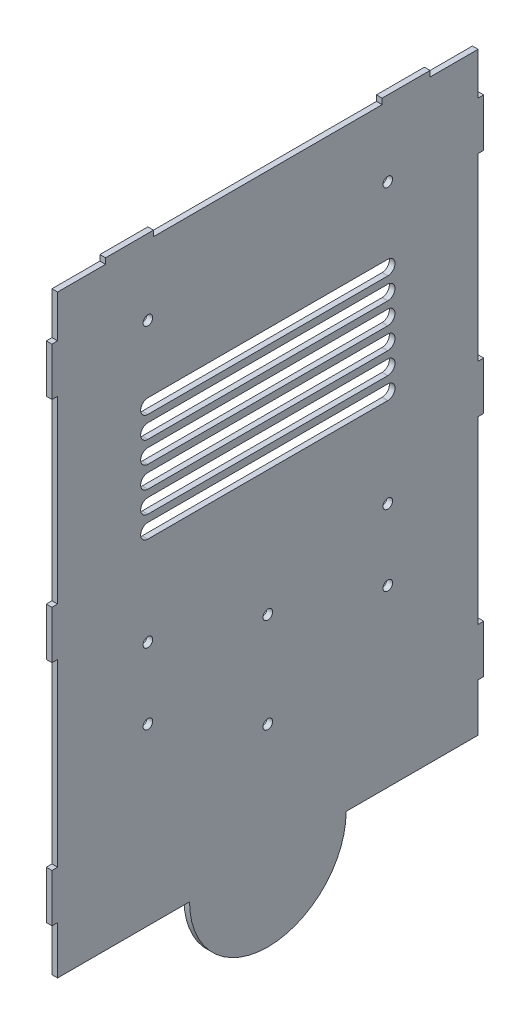
from build123d import *

# Parameters (mm, degrees)
BOSS_EXTRUDE1_DEPTH = 2.3622
SKETCH2_R           = 2
CUT_EXTRUDE1_DEPTH  = 242.723455562


with BuildPart() as part:
    # Sketch1 → Boss-Extrude1 (new body)
    with BuildSketch(Plane(origin=(0, 0, 0), x_dir=(0, 0, -1), z_dir=(1, 0, 0))):
        with BuildLine():
            Line((-130.13293856, 199.80032679), (-130.13293856, 182.16252679))
            Line((-130.13293856, 182.16252679), (-132.49513856, 182.16252679))
            Line((-132.49513856, 182.16252679), (-132.49513856, 162.16252679))
            Line((-132.49513856, 162.16252679), (-130.13293856, 162.16252679))
            Line((-130.13293856, 162.16252679), (-130.13293856, 87.16252679))
            Line((-130.13293856, 87.16252679), (-132.49513856, 87.16252679))
            Line((-132.49513856, 87.16252679), (-132.49513856, 67.16252679))
            Line((-132.49513856, 67.16252679), (-130.13293856, 67.16252679))
            Line((-130.13293856, 67.16252679), (-130.13293856, -7.83747321))
            Line((-130.13293856, -7.83747321), (-132.49513856, -7.83747321))
            Line((-132.49513856, -7.83747321), (-132.49513856, -27.83747321))
            Line((-132.49513856, -27.83747321), (-130.13293856, -27.83747321))
            Line((-130.13293856, -27.83747321), (-130.13293856, -47.83747321))
            Line((-130.13293856, -47.83747321), (-75.13293856, -47.83747321))
            ThreePointArc((-75.13293856, -47.83747321), (-42.49513856, -80.47527321), (-9.85733856, -47.83747321))
            Line((-9.85733856, -47.83747321), (45.14266144, -47.83747321))
            Line((45.14266144, -47.83747321), (45.14266144, -27.83747321))
            Line((45.14266144, -27.83747321), (47.50486144, -27.83747321))
            Line((47.50486144, -27.83747321), (47.50486144, -7.83747321))
            Line((47.50486144, -7.83747321), (45.14266144, -7.83747321))
            Line((45.14266144, -7.83747321), (45.14266144, 67.16252679))
            Line((45.14266144, 67.16252679), (47.50486144, 67.16252679))
            Line((47.50486144, 67.16252679), (47.50486144, 87.16252679))
            Line((47.50486144, 87.16252679), (45.14266144, 87.16252679))
            Line((45.14266144, 87.16252679), (45.14266144, 162.16252679))
            Line((45.14266144, 162.16252679), (47.50486144, 162.16252679))
            Line((47.50486144, 162.16252679), (47.50486144, 182.16252679))
            Line((47.50486144, 182.16252679), (45.14266144, 182.16252679))
            Line((45.14266144, 182.16252679), (45.14266144, 199.80032679))
            Line((45.14266144, 199.80032679), (25.14266144, 199.80032679))
            Line((25.14266144, 199.80032679), (25.14266144, 202.16252679))
            Line((25.14266144, 202.16252679), (5.14266144, 202.16252679))
            Line((5.14266144, 202.16252679), (5.14266144, 199.80032679))
            Line((5.14266144, 199.80032679), (-90.13293856, 199.80032679))
            Line((-90.13293856, 199.80032679), (-90.13293856, 202.16252679))
            Line((-90.13293856, 202.16252679), (-110.13293856, 202.16252679))
            Line((-110.13293856, 202.16252679), (-110.13293856, 199.80032679))
            Line((-110.13293856, 199.80032679), (-130.13293856, 199.80032679))
        make_face()
    extrude(amount=BOSS_EXTRUDE1_DEPTH)

    # Sketch2 → Cut-Extrude1 (cut, through all)
    with BuildSketch(Plane(origin=(2.3622, 0, 0), x_dir=(0, 0, -1), z_dir=(1, 0, 0))):
        with Locations((-92.49513856, 54.59655139)):
            Circle(SKETCH2_R)
        with Locations((7.50486144, 54.59655139)):
            Circle(SKETCH2_R)
        with Locations((7.50486144, 25.043037435)):
            Circle(SKETCH2_R)
        with Locations((-92.49513856, 170.771110124)):
            Circle(SKETCH2_R)
        with Locations((7.50486144, 170.771110124)):
            Circle(SKETCH2_R)
        with Locations((-92.49513856, 25.043037435)):
            Circle(SKETCH2_R)
        with Locations((-42.49513856, 39.546662347)):
            Circle(SKETCH2_R)
        with Locations((-42.49513856, 0)):
            Circle(SKETCH2_R)
        with BuildLine():
            Line((-92.49513856, 142.80032679), (7.50486144, 142.80032679))
            ThreePointArc((7.50486144, 142.80032679), (10.50486144, 139.80032679), (7.50486144, 136.80032679))
            Line((7.50486144, 136.80032679), (-92.49513856, 136.80032679))
            ThreePointArc((-92.49513856, 136.80032679), (-95.49513856, 139.80032679), (-92.49513856, 142.80032679))
        make_face()
        with BuildLine():
            Line((-92.49513856, 133.80032679), (7.50486144, 133.80032679))
            ThreePointArc((7.50486144, 133.80032679), (10.50486144, 130.80032679), (7.50486144, 127.80032679))
            Line((7.50486144, 127.80032679), (-92.49513856, 127.80032679))
            ThreePointArc((-92.49513856, 127.80032679), (-95.49513856, 130.80032679), (-92.49513856, 133.80032679))
        make_face()
        with BuildLine():
            Line((-92.49513856, 124.80032679), (7.50486144, 124.80032679))
            ThreePointArc((7.50486144, 124.80032679), (10.50486144, 121.80032679), (7.50486144, 118.80032679))
            Line((7.50486144, 118.80032679), (-92.49513856, 118.80032679))
            ThreePointArc((-92.49513856, 118.80032679), (-95.49513856, 121.80032679), (-92.49513856, 124.80032679))
        make_face()
        with BuildLine():
            Line((-92.49513856, 115.80032679), (7.50486144, 115.80032679))
            ThreePointArc((7.50486144, 115.80032679), (10.50486144, 112.80032679), (7.50486144, 109.80032679))
            Line((7.50486144, 109.80032679), (-92.49513856, 109.80032679))
            ThreePointArc((-92.49513856, 109.80032679), (-95.49513856, 112.80032679), (-92.49513856, 115.80032679))
        make_face()
        with BuildLine():
            Line((-92.49513856, 106.80032679), (7.50486144, 106.80032679))
            ThreePointArc((7.50486144, 106.80032679), (10.50486144, 103.80032679), (7.50486144, 100.80032679))
            Line((7.50486144, 100.80032679), (-92.49513856, 100.80032679))
            ThreePointArc((-92.49513856, 100.80032679), (-95.49513856, 103.80032679), (-92.49513856, 106.80032679))
        make_face()
        with BuildLine():
            Line((-92.49513856, 97.80032679), (7.50486144, 97.80032679))
            ThreePointArc((7.50486144, 97.80032679), (10.50486144, 94.80032679), (7.50486144, 91.80032679))
            Line((7.50486144, 91.80032679), (-92.49513856, 91.80032679))
            ThreePointArc((-92.49513856, 91.80032679), (-95.49513856, 94.80032679), (-92.49513856, 97.80032679))
        make_face()
    extrude(amount=-CUT_EXTRUDE1_DEPTH, mode=Mode.SUBTRACT)


solid = part.part
